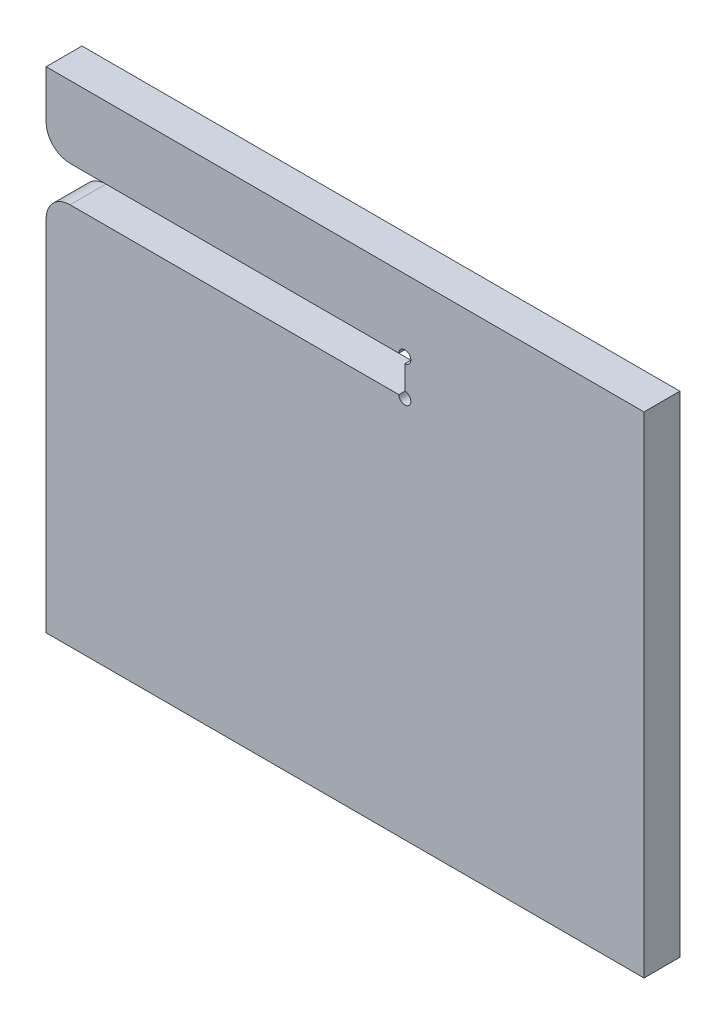
from build123d import *

# Parameters (mm, degrees)
SKETCH1_W           = 50
SKETCH1_H           = 41
BOSS_EXTRUDE1_DEPTH = 3
CUT_EXTRUDE1_DEPTH  = 47.19523785
FILLET1_R           = 2


with BuildPart() as part:
    # Sketch1 → Boss-Extrude1 (new body)
    with BuildSketch(Plane.XY):
        with Locations((-5, -14.5)):
            Rectangle(SKETCH1_W, SKETCH1_H)
    extrude(amount=BOSS_EXTRUDE1_DEPTH)

    # Sketch2 → Cut-Extrude1 (cut, through all)
    with BuildSketch(Plane.XY):
        with BuildLine():
            Line((-30, 0), (-0.5, 0))
            ThreePointArc((-0.5, 0), (0.353553391, 0.353553391), (0, -0.5))
            Line((0, -0.5), (0, -2.5))
            ThreePointArc((0, -2.5), (0.353553391, -3.353553391), (-0.5, -3))
            Line((-0.5, -3), (-30, -3))
            Line((-30, -3), (-30, 0))
        make_face()
    extrude(amount=CUT_EXTRUDE1_DEPTH, mode=Mode.SUBTRACT)

    # Fillet1
    fillet1_edges = [part.edges().sort_by_distance(p)[0] for p in [
        (-30, 0, 1.5),
        (-30, -3, 1.5),
    ]]
    fillet(fillet1_edges, radius=FILLET1_R)


solid = part.part
